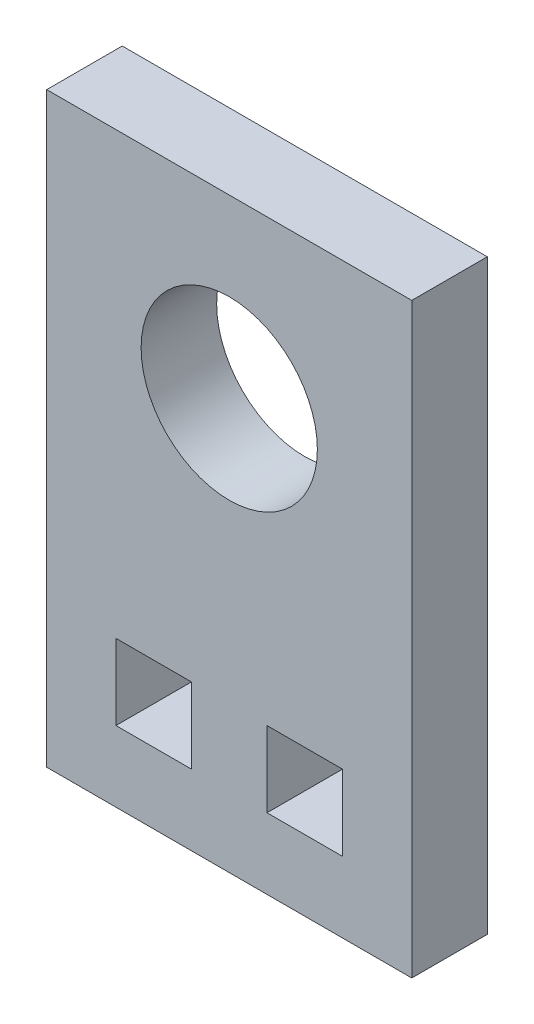
from build123d import *

# Parameters (mm, degrees)
SKETCH1_R           = 3.5
SKETCH1_W           = 3
SKETCH1_H           = 3
BOSS_EXTRUDE1_DEPTH = 3


with BuildPart() as part:
    # Sketch1 → Boss-Extrude1 (new body)
    with BuildSketch(Plane.XY):
        Polygon((-7.206431168, -7.130585607), (-7.206431168, 13.369414393), (7.293568832, 13.369414393), (7.293568832, -6.939685402), (7.293568832, -9.939685402), (-7.206431168, -9.939685402), align=None)
        with Locations((0.043568832, 6.369414393)):
            Circle(SKETCH1_R, mode=Mode.SUBTRACT)
        with Locations((-2.956431168, -5.630585607)):
            Rectangle(SKETCH1_W, SKETCH1_H, mode=Mode.SUBTRACT)
        with Locations((3.043568832, -5.630585607)):
            Rectangle(SKETCH1_W, SKETCH1_H, mode=Mode.SUBTRACT)
    extrude(amount=BOSS_EXTRUDE1_DEPTH)


solid = part.part
